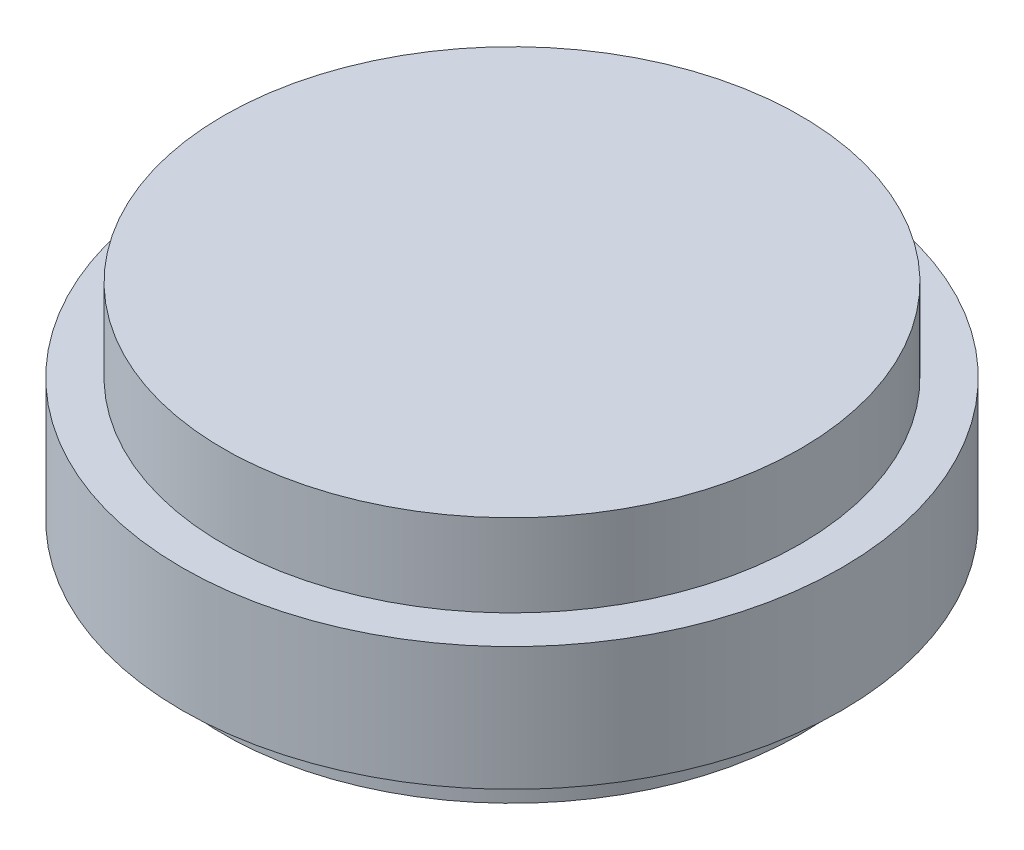
from build123d import *


with BuildPart() as part:
    # Esquisse1 → Révolution1 (revolve)
    with BuildSketch(Plane.XY, mode=Mode.PRIVATE) as r_volution1_sk:
        Polygon((0, 0), (3.5, 0), (3.5, 0.5), (4, 0.5), (4, 2), (3.5, 2), (3.5, 3), (0, 3), align=None)
    revolve(r_volution1_sk.sketch.rotate(Axis((0, 3, 0), (0, -1, 0)), 180), axis=Axis((0, 3, 0), (0, -1, 0)))


solid = part.part
